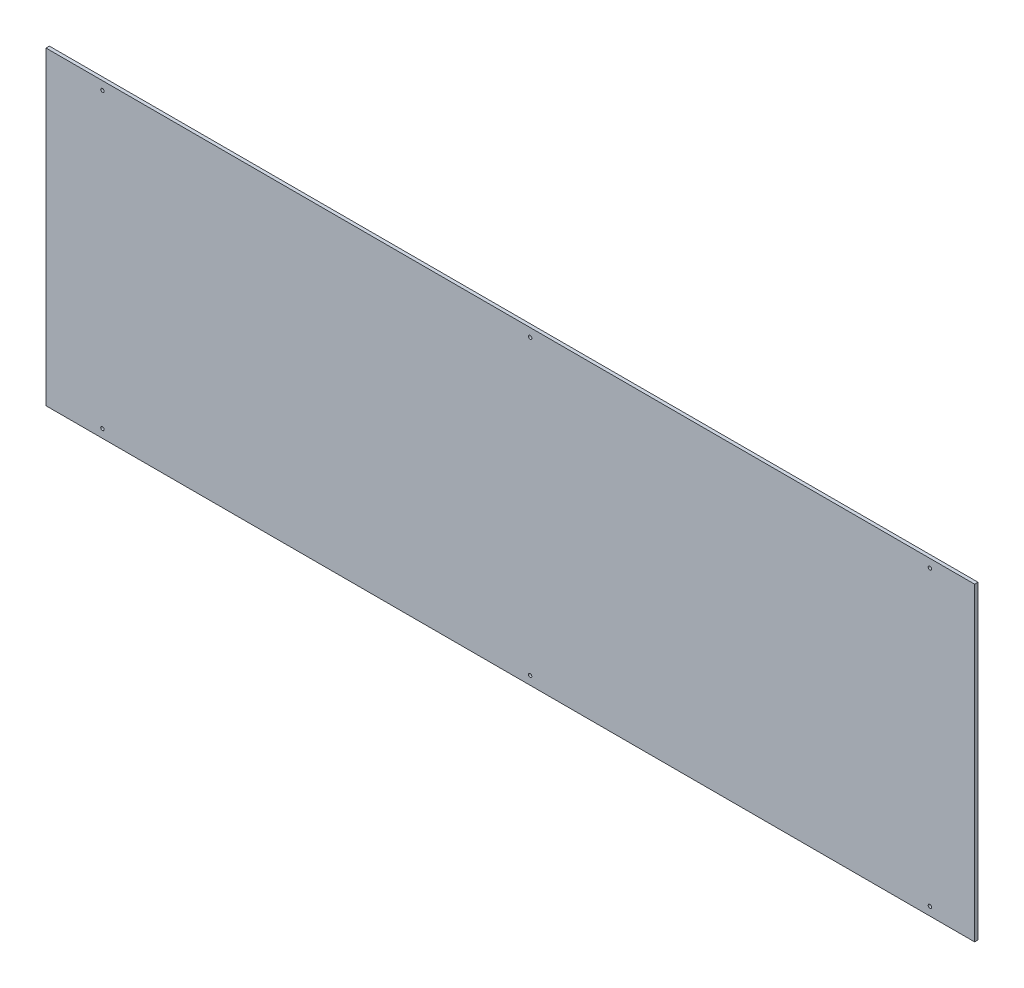
from build123d import *

# Parameters (mm, degrees)
SKETCH_1_W          = 1100
SKETCH_1_H          = 367
EXTRUDE_1_DEPTH     = 4
SKETCH_2_R          = 2
CUT_EXTRUDE_1_DEPTH = 4


with BuildPart() as part:
    # 草图1 → 凸台-拉伸1 (new body)
    with BuildSketch(Plane.XY):
        with Locations((498.130065577, 144.859791332)):
            Rectangle(SKETCH_1_W, SKETCH_1_H)
    extrude(amount=EXTRUDE_1_DEPTH)

    # 草图2 → 切除-拉伸1 (cut)
    with BuildSketch(Plane.XY.offset(4)):
        with Locations((14.956509488, 318.359791332)):
            Circle(SKETCH_2_R)
        with Locations((521.629317091, 318.359791332)):
            Circle(SKETCH_2_R)
        with Locations((995.134492499, 318.359791332)):
            Circle(SKETCH_2_R)
        with Locations((995.134492499, -28.640208668)):
            Circle(SKETCH_2_R)
        with Locations((521.629317091, -28.640208668)):
            Circle(SKETCH_2_R)
        with Locations((14.956509488, -28.640208668)):
            Circle(SKETCH_2_R)
    extrude(amount=-CUT_EXTRUDE_1_DEPTH, mode=Mode.SUBTRACT)


solid = part.part
